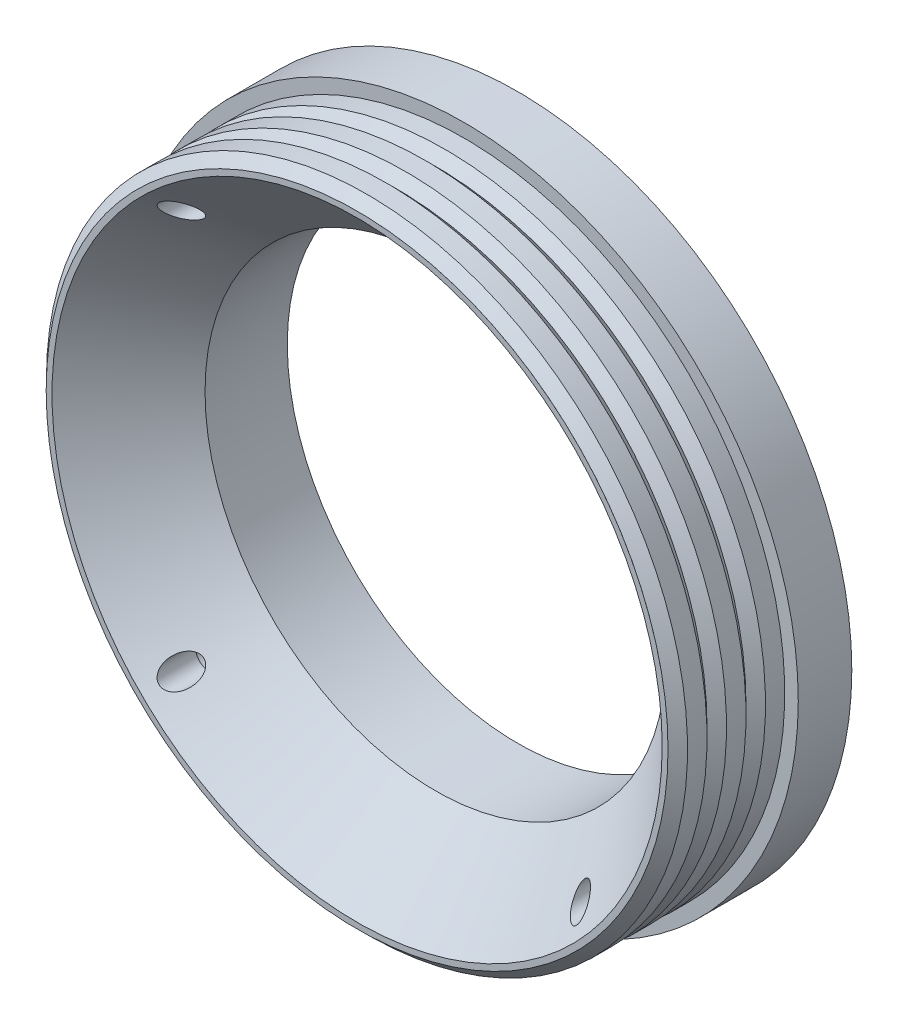
from build123d import *

# Parameters (mm, degrees)
SKETCH2_R                  = 39.624
SKETCH2_R_2                = 27.3304
BOSS_EXTRUDE2_DEPTH        = 6.35
SKETCH5_R                  = 38.018820021
SKETCH5_R_2                = 27.3304
BOSS_EXTRUDE3_DEPTH        = 19.05
F_10_32_TAPPED_HOLE1_D     = 4.0386
F_10_32_TAPPED_HOLE1_DEPTH = 12.7
F_10_32_TAPPED_HOLE1_TIP   = 1.213317848
CUT_EXTRUDE2_DEPTH         = 60.186360354
CUT_EXTRUDE2_DEPTH_BACK    = 60.186360354
SKETCH16_R                 = 1.524


with BuildPart() as part:
    # Sketch2 → Boss-Extrude2 (new body)
    with BuildSketch(Plane.XY):
        Circle(SKETCH2_R)
        Circle(SKETCH2_R_2, mode=Mode.SUBTRACT)
    extrude(amount=BOSS_EXTRUDE2_DEPTH)

    # Sketch5 → Boss-Extrude3 (add)
    with BuildSketch(Plane.XY):
        Circle(SKETCH5_R)
        Circle(SKETCH5_R_2, mode=Mode.SUBTRACT)
    extrude(amount=BOSS_EXTRUDE3_DEPTH)

    # Sketch10 → Cut-Revolve2 (revolve, cut)
    with BuildSketch(Plane(origin=(0, 0, 0), x_dir=(0, 0, -1), z_dir=(1, 0, 0))):
        Polygon((-29.4386, 38.018820021), (-27.1272, 38.018820021), (-28.2829, 36.863120021), align=None)
        Polygon((-24.8158, 38.018820021), (-22.5044, 38.018820021), (-23.6601, 36.863120021), align=None)
        Polygon((-20.193, 38.018820021), (-17.8816, 38.018820021), (-19.0373, 36.863120021), align=None)
        Polygon((-15.5702, 38.018820021), (-13.2588, 38.018820021), (-14.4145, 36.863120021), align=None)
        Polygon((-10.9474, 38.018820021), (-8.636, 38.018820021), (-9.7917, 36.863120021), align=None)
    revolve(axis=Axis((0, 0, 50.084179241), (0, 0, 1)), mode=Mode.SUBTRACT)

    # Sketch11 → Cut-Revolve3 (revolve, cut)
    with BuildSketch(Plane(origin=(0, 0, 0), x_dir=(0, 0, -1), z_dir=(1, 0, 0))):
        Polygon((-19.685, 36.788548166), (-6.35, 24.088548166), (-19.685, 24.088548166), align=None)
    revolve(axis=Axis((0, 0, 43.100386529), (0, 0, 1)), mode=Mode.SUBTRACT)

    # #10-32 Tapped Hole1
    with Locations(Plane(origin=(0, 0, 0), x_dir=(1, 0, 0), z_dir=(0, 0, -1))):
        with Locations((23.671955135, 23.671955135), (0, 0), (23.671955135, -23.671955135), (-23.671955135, 23.671955135), (-23.671955135, -23.671955135)):
            Hole(F_10_32_TAPPED_HOLE1_D / 2, depth=F_10_32_TAPPED_HOLE1_DEPTH)
            with Locations((0, 0, -(F_10_32_TAPPED_HOLE1_DEPTH + F_10_32_TAPPED_HOLE1_TIP / 2))):  # 118° drill point
                Cone(0, F_10_32_TAPPED_HOLE1_D / 2, F_10_32_TAPPED_HOLE1_TIP, mode=Mode.SUBTRACT)

    # Sketch16 → Cut-Extrude2 (cut, two sides: drawn at the far end of the back side and taken through both)
    with BuildSketch(Plane(origin=(0, 0, 0), x_dir=(-1, 0, 0), z_dir=(0, 0, -1)).offset(-CUT_EXTRUDE2_DEPTH_BACK)):
        with Locations((23.671955135, 23.671955135)):
            Circle(SKETCH16_R)
        with Locations((-23.671955135, 23.671955135)):
            Circle(SKETCH16_R)
        with Locations((-23.671955135, -23.671955135)):
            Circle(SKETCH16_R)
        with Locations((23.671955135, -23.671955135)):
            Circle(SKETCH16_R)
    extrude(amount=CUT_EXTRUDE2_DEPTH + CUT_EXTRUDE2_DEPTH_BACK, mode=Mode.SUBTRACT)


solid = part.part
